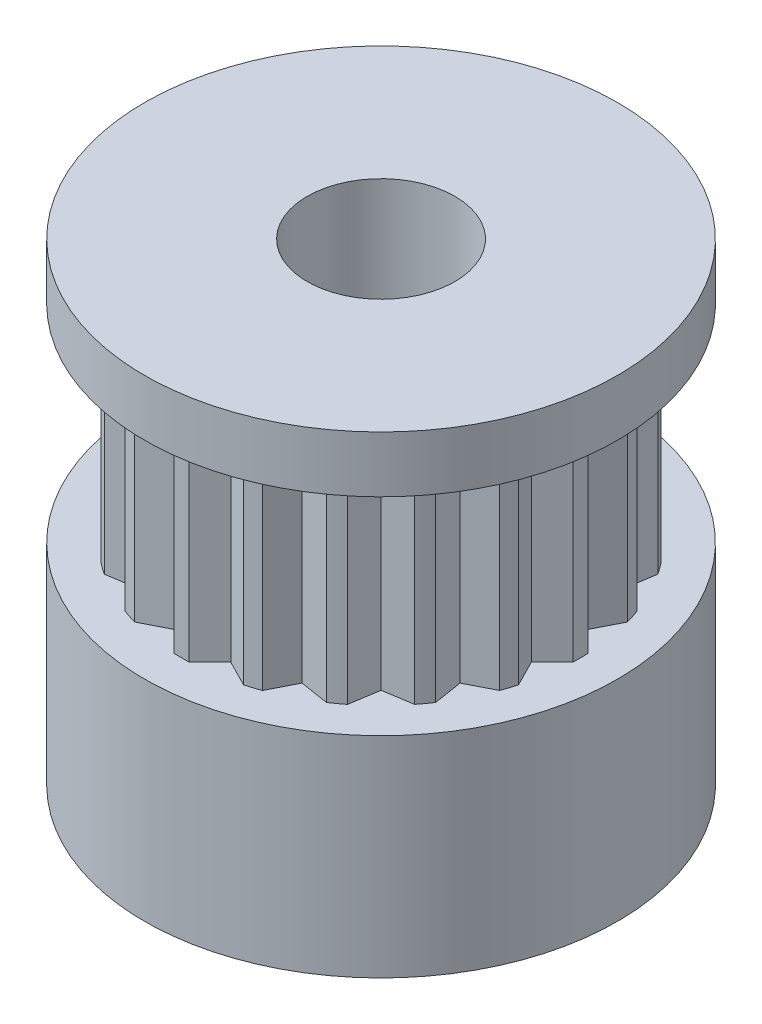
from build123d import *

# Parameters (mm, degrees)
BOSS_EXTRUDE1_DEPTH = 7
CIRPATTERN1_COUNT   = 20
SKETCH4_R           = 7.5
SKETCH4_R_2         = 6.75
CUT_EXTRUDE1_DEPTH  = 7


with BuildPart() as part:
    # Sketch2 → Revolve1 (revolve)
    with BuildSketch(Plane.XY, mode=Mode.PRIVATE) as revolve1_sk:
        Polygon((-2.5, 0), (-8, 0), (-8, 7.1), (-6.11, 7.1), (-6.11, 14.1), (-8, 14.1), (-8, 16), (-2.5, 16), align=None)
    revolve(revolve1_sk.sketch.rotate(Axis((0, 0, 0), (0, 1, 0)), 270), axis=Axis((0, 0, 0), (0, 1, 0)))

    # Sketch3 → Boss-Extrude1 (add)
    with BuildSketch(Plane(origin=(0, 7.1, 0), x_dir=(1, 0, 0), z_dir=(0, 1, 0))):
        Polygon((-6, 1), (-6, -1), (-7, 0), align=None)
    boss_extrude1 = extrude(amount=BOSS_EXTRUDE1_DEPTH)

    # CirPattern1: Boss-Extrude1 ×20 about axis
    cirpattern1_axis = Axis((0, 0, 0), (0, 1, 0))
    for i in range(1, CIRPATTERN1_COUNT):
        add(boss_extrude1.rotate(cirpattern1_axis, i * 360 / CIRPATTERN1_COUNT))

    # Sketch4 → Cut-Extrude1 (cut)
    with BuildSketch(Plane(origin=(0, 7.1, 0), x_dir=(1, 0, 0), z_dir=(0, 1, 0))):
        Circle(SKETCH4_R)
        Circle(SKETCH4_R_2, mode=Mode.SUBTRACT)
    extrude(amount=CUT_EXTRUDE1_DEPTH, mode=Mode.SUBTRACT)


solid = part.part
